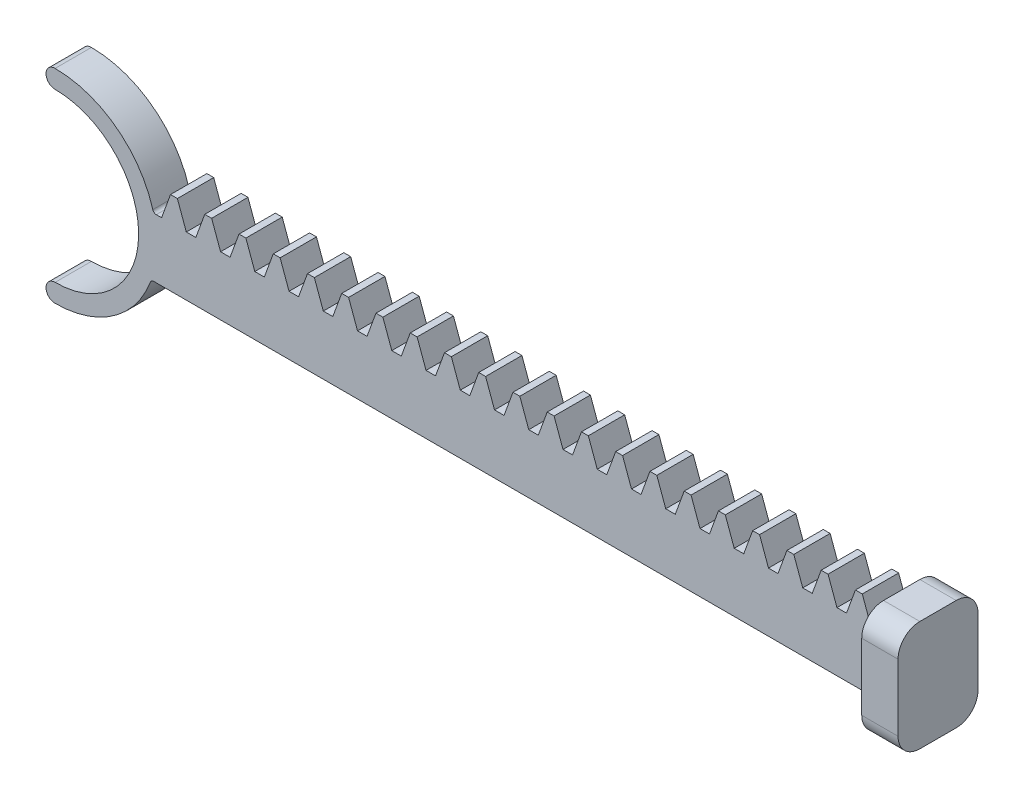
from build123d import *

# Parameters (mm, degrees)
BLANKSKE_W         = 100
BLANKSKE_H         = 11.5
BLANK_DEPTH        = 5
TOOTHCUTSIM_DEPTH  = 101.783183121
TEETHCUTS_COUNT    = 22
TEETHCUTS_PITCH    = 4.712388975
BOSS_EXTRU_1_DEPTH = 5
BOSS_EXTRU_2_DEPTH = 5


with BuildPart() as part:
    # BlankSke → Blank (new body)
    with BuildSketch(Plane.XY):
        with Locations((50, 5.75)):
            Rectangle(BLANKSKE_W, BLANKSKE_H)
    extrude(amount=-BLANK_DEPTH)

    # TooCutSkeSim → ToothCutSim (cut, through all)
    with BuildSketch(Plane.XY):
        Polygon((0.654653055, 8.125), (-0.654653055, 8.125), (-1.892297439, 11.5254), (1.892297439, 11.5254), align=None)
    toothcutsim = extrude(amount=-TOOTHCUTSIM_DEPTH, mode=Mode.SUBTRACT)

    # TeethCuts: ToothCutSim ×22
    with Locations(*[(i * TEETHCUTS_PITCH, 0, 0) for i in range(1, TEETHCUTS_COUNT)]):
        add(toothcutsim, mode=Mode.SUBTRACT)

    # Esquisse1 → Boss.-Extru.1 (add)
    with BuildSketch(Plane(origin=(100, 0, 0), x_dir=(0, 0, -1), z_dir=(1, 0, 0))):
        with BuildLine():
            Line((5, 12.18326915), (0, 12.18326915))
            ThreePointArc((0, 12.18326915), (-2.121320344, 11.304589494), (-3, 9.18326915))
            Line((-3, 9.18326915), (-3, 0))
            ThreePointArc((-3, 0), (-2.121320344, -2.121320344), (0, -3))
            Line((0, -3), (5, -3))
            ThreePointArc((5, -3), (7.121320344, -2.121320344), (8, 0))
            Line((8, 0), (8, 9.18326915))
            ThreePointArc((8, 9.18326915), (7.121320344, 11.304589494), (5, 12.18326915))
        make_face()
    extrude(amount=BOSS_EXTRU_1_DEPTH)

    # Esquisse2 → Boss.-Extru.2 (add)
    with BuildSketch(Plane(origin=(0, 0, -5), x_dir=(-1, 0, 0), z_dir=(0, 0, -1))):
        with BuildLine():
            Line((0, 8.125), (0.072259216, 8.125))
            ThreePointArc((0.072259216, 8.125), (0.372641653, 8.225287114), (0.552526139, 8.485918434))
            ThreePointArc((0.552526139, 8.485918434), (5.589291766, 15.783595396), (14, 18.591634575))
            ThreePointArc((14, 18.591634575), (15.25, 17.341634575), (14, 16.091634575))
            ThreePointArc((14, 16.091634575), (2.5, 4.591634575), (14, -6.908365425))
            ThreePointArc((14, -6.908365425), (15.25, -8.158365425), (14, -9.408365425))
            ThreePointArc((14, -9.408365425), (6.025818336, -6.915425292), (0.891516314, -0.324426394))
            ThreePointArc((0.891516314, -0.324426394), (0.708148385, -0.089033576), (0.423356182, 0))
            Line((0.423356182, 0), (0, 0))
            Line((0, 0), (0, 8.125))
        make_face()
    extrude(amount=-BOSS_EXTRU_2_DEPTH)


solid = part.part
